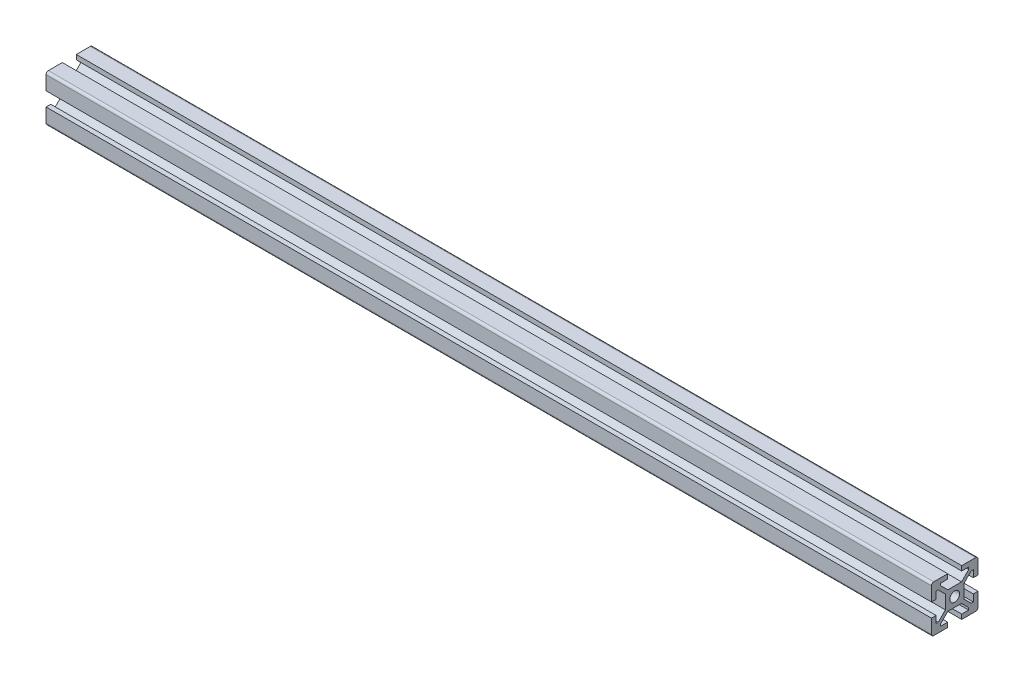
from build123d import *

# Parameters (mm, degrees)
SKETCH1_R                = 2.1
BOSS_EXTRUDE1_DEPTH      = 380
SKETCH_1_R               = 2.1
CUT_EXTRUDE_1_DEPTH      = 381.389274297
PATTERN_LINEAR_1_COUNT   = 2
PATTERN_LINEAR_1_PITCH   = 80
MIRROR_2_COPY_1_SKETCH_R = 2.1
MIRROR_2_COPY_1_DEPTH    = 381.389274297
MIRROR_2_COPY_2_SKETCH_R = 2.1
MIRROR_2_COPY_2_DEPTH    = 381.389274297


with BuildPart() as part:
    # Sketch1 → Boss-Extrude1 (new body)
    with BuildSketch(Plane(origin=(0, 0, 0), x_dir=(0, 0, -1), z_dir=(1, 0, 0))):
        with BuildLine():
            Line((-10, 9), (-10, 3))
            Line((-10, 3), (-8, 3))
            Line((-8, 3), (-8, 6))
            Line((-8, 6), (-7.060660172, 6))
            Line((-7.060660172, 6), (-4, 2.939339828))
            Line((-4, 2.939339828), (-4, -2.939339828))
            Line((-4, -2.939339828), (-7.060660172, -6))
            Line((-7.060660172, -6), (-8, -6))
            Line((-8, -6), (-8, -3))
            Line((-8, -3), (-10, -3))
            Line((-10, -3), (-10, -9))
            ThreePointArc((-10, -9), (-9.707106781, -9.707106781), (-9, -10))
            Line((-9, -10), (-3, -10))
            Line((-3, -10), (-3, -8))
            Line((-3, -8), (-6, -8))
            Line((-6, -8), (-6, -7.060660172))
            Line((-6, -7.060660172), (-2.939339828, -4))
            Line((-2.939339828, -4), (2.939339828, -4))
            Line((2.939339828, -4), (6, -7.060660172))
            Line((6, -7.060660172), (6, -8))
            Line((6, -8), (3, -8))
            Line((3, -8), (3, -10))
            Line((3, -10), (9, -10))
            ThreePointArc((9, -10), (9.707106781, -9.707106781), (10, -9))
            Line((10, -9), (10, -3))
            Line((10, -3), (8, -3))
            Line((8, -3), (8, -6))
            Line((8, -6), (7.060660172, -6))
            Line((7.060660172, -6), (4, -2.939339828))
            Line((4, -2.939339828), (4, 2.939339828))
            Line((4, 2.939339828), (7.060660172, 6))
            Line((7.060660172, 6), (8, 6))
            Line((8, 6), (8, 3))
            Line((8, 3), (10, 3))
            Line((10, 3), (10, 9))
            ThreePointArc((10, 9), (9.707106781, 9.707106781), (9, 10))
            Line((9, 10), (3, 10))
            Line((3, 10), (3, 8))
            Line((3, 8), (6, 8))
            Line((6, 8), (6, 7.060660172))
            Line((6, 7.060660172), (2.939339828, 4))
            Line((2.939339828, 4), (-2.939339828, 4))
            Line((-2.939339828, 4), (-6, 7.060660172))
            Line((-6, 7.060660172), (-6, 8))
            Line((-6, 8), (-3, 8))
            Line((-3, 8), (-3, 10))
            Line((-3, 10), (-9, 10))
            ThreePointArc((-9, 10), (-9.707106781, 9.707106781), (-10, 9))
        make_face()
        Circle(SKETCH1_R, mode=Mode.SUBTRACT)
    extrude(amount=BOSS_EXTRUDE1_DEPTH)

    # 草图1 → 切除-拉伸1 (cut, through all)
    with BuildSketch(Plane(origin=(0, 4, 0), x_dir=(1, 0, 0), z_dir=(0, 1, 0))):
        with Locations((140, 0)):
            Circle(SKETCH_1_R)
    cut_extrude_1 = extrude(amount=-CUT_EXTRUDE_1_DEPTH, mode=Mode.SUBTRACT)

    # 阵列(线性)1: 切除-拉伸1 ×2
    with Locations(*[(-i * PATTERN_LINEAR_1_PITCH, 0, 0) for i in range(1, PATTERN_LINEAR_1_COUNT)]):
        add(cut_extrude_1, mode=Mode.SUBTRACT)

    # 镜向2 copy 1 sketch → 镜向2 copy 1 (cut, through all)
    with BuildSketch(Plane(origin=(460, 4, 0), x_dir=(-1, 0, 0), z_dir=(0, 1, 0))):
        with Locations((140, 0)):
            Circle(MIRROR_2_COPY_1_SKETCH_R)
    extrude(amount=-MIRROR_2_COPY_1_DEPTH, mode=Mode.SUBTRACT)

    # 镜向2 copy 2 sketch → 镜向2 copy 2 (cut, through all)
    with BuildSketch(Plane(origin=(380, 4, 0), x_dir=(-1, 0, 0), z_dir=(0, 1, 0))):
        with Locations((140, 0)):
            Circle(MIRROR_2_COPY_2_SKETCH_R)
    extrude(amount=-MIRROR_2_COPY_2_DEPTH, mode=Mode.SUBTRACT)


solid = part.part
